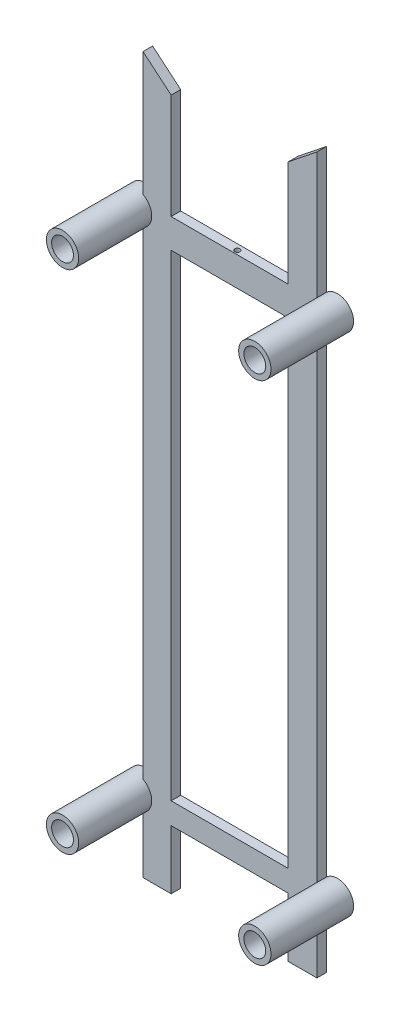
from build123d import *

# Parameters (mm, degrees)
BOSS_EXTRUDE1_START   = 600
SKETCH1_R             = 57.281017464
SKETCH1_R_2           = 38.771715285
BOSS_EXTRUDE1_DEPTH   = 293
SKETCH1_R_3           = 57.28102
SKETCH1_R_4           = 38.771715
BOSS_EXTRUDE1_2_DEPTH = 293
BOSS_EXTRUDE1_3_DEPTH = 293
BOSS_EXTRUDE1_4_DEPTH = 293
SKETCH2_W             = 415.282978995
SKETCH2_H             = 1690.728499163
BOSS_EXTRUDE2_DEPTH   = 34
SKETCH6_R             = 9.313662058
CUT_EXTRUDE3_DEPTH    = 126


with BuildPart() as part:
    # Sketch1 → Boss-Extrude1 (new body)
    with BuildSketch(Plane.XY.offset(427.014108562).offset(BOSS_EXTRUDE1_START)):
        with Locations((1173.639225527, -317.201613393)):
            Circle(SKETCH1_R)
        with Locations((1173.639225527, -317.201613393)):
            Circle(SKETCH1_R_2, mode=Mode.SUBTRACT)
    extrude(amount=BOSS_EXTRUDE1_DEPTH)



with BuildPart() as body_2:
    # Sketch1 → Boss-Extrude1 2 (new body)
    with BuildSketch(Plane.XY.offset(427.014108562).offset(BOSS_EXTRUDE1_START)):
        with Locations((491.765116758, -317.201613393)):
            Circle(SKETCH1_R_3)
        with Locations((491.765116758, -317.201613393)):
            Circle(SKETCH1_R_4, mode=Mode.SUBTRACT)
    extrude(amount=BOSS_EXTRUDE1_2_DEPTH)


with BuildPart() as body_3:
    # Sketch1 → Boss-Extrude1 3 (new body)
    with BuildSketch(Plane.XY.offset(427.014108562).offset(BOSS_EXTRUDE1_START)):
        with Locations((491.765116758, -2112.860849235)):
            Circle(SKETCH1_R_3)
        with Locations((491.765116758, -2112.860849235)):
            Circle(SKETCH1_R_4, mode=Mode.SUBTRACT)
    extrude(amount=BOSS_EXTRUDE1_3_DEPTH)


with BuildPart() as body_4:
    # Sketch1 → Boss-Extrude1 4 (new body)
    with BuildSketch(Plane.XY.offset(427.014108562).offset(BOSS_EXTRUDE1_START)):
        with Locations((1173.639225527, -2112.860849235)):
            Circle(SKETCH1_R_3)
        with Locations((1173.639225527, -2112.860849235)):
            Circle(SKETCH1_R_4, mode=Mode.SUBTRACT)
    extrude(amount=BOSS_EXTRUDE1_4_DEPTH)


with BuildPart() as part_1:
    add(part.part)

    add(body_2.part)  # Boss-Extrude2 merges body 2

    add(body_3.part)  # Boss-Extrude2 merges body 3

    add(body_4.part)  # Boss-Extrude2 merges body 4
    # Sketch2 → Boss-Extrude2 (add)
    with BuildSketch(Plane(origin=(0, 0, 1027.014108562), x_dir=(-1, 0, 0), z_dir=(0, 0, -1))):
        Polygon((-1033.166693927, -2154.506262869), (-617.883714932, -2154.506262869), (-617.883714932, -2363.997444221), (-518.159541103, -2363.997444221), (-518.159541103, 172.765208514), (-617.883714932, 88.905828795), (-617.883714932, -284.095196719), (-1033.166693927, -284.095196719), (-1033.166693927, 91.617150216), (-1134.867510242, 172.765208514), (-1134.867510242, -2363.997444221), (-1033.166693927, -2363.997444221), align=None)
        with Locations((-825.52520443, -1232.946709341)):
            Rectangle(SKETCH2_W, SKETCH2_H, mode=Mode.SUBTRACT)
    extrude(amount=-BOSS_EXTRUDE2_DEPTH)

    # Sketch6 → Cut-Extrude3 (cut)
    with BuildSketch(Plane(origin=(0, -284.095196719, 0), x_dir=(1, 0, 0), z_dir=(0, 1, 0))):
        with Locations(Location((838.898443774, -1047.155157013, 0), (0, 0, 270))):
            Circle(SKETCH6_R)
    extrude(amount=-CUT_EXTRUDE3_DEPTH, mode=Mode.SUBTRACT)


solid = part_1.part
